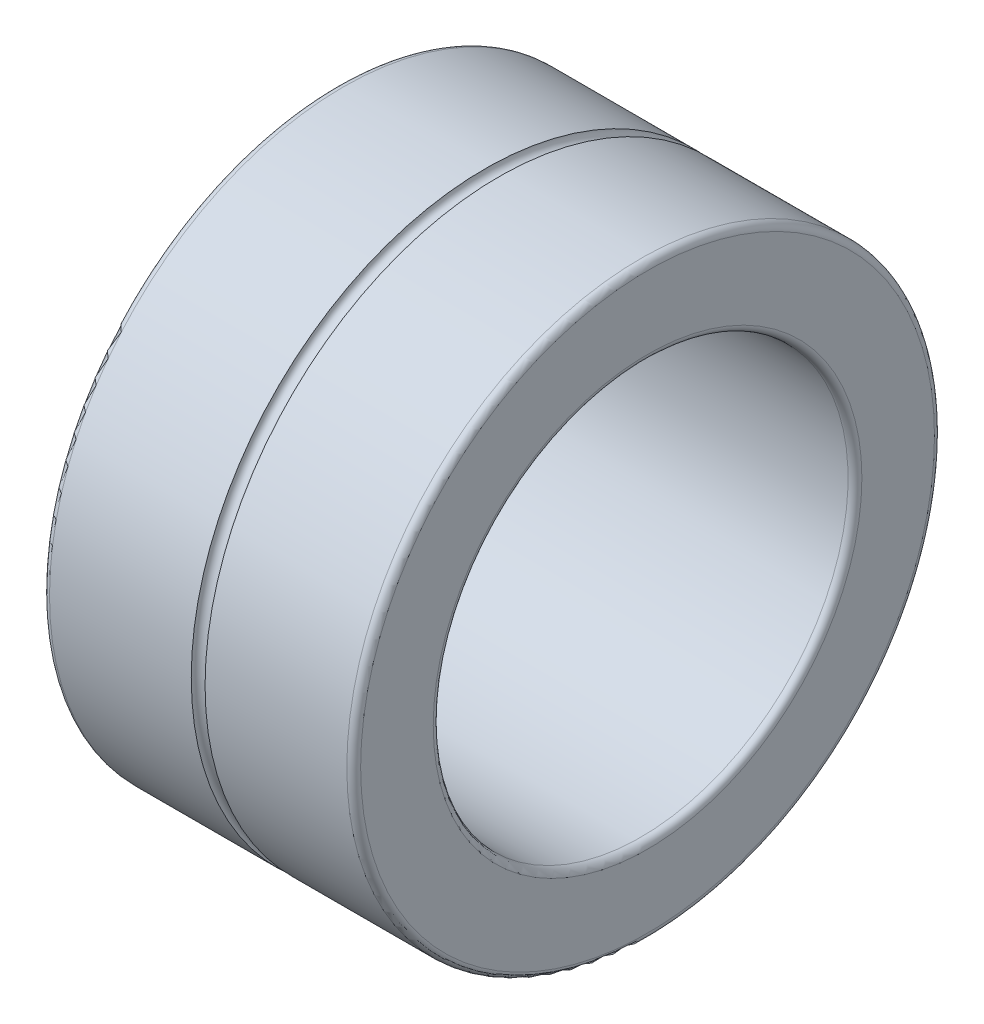
from build123d import *

# Parameters (mm, degrees)
FILLET1_R = 1


with BuildPart() as part:
    # Sketch1 → Revolve1 (revolve)
    with BuildSketch(Plane.XY, mode=Mode.PRIVATE) as revolve1_sk:
        with BuildLine():
            Line((0, 30), (0, 42.5))
            Line((0, 42.5), (21.5, 42.5))
            ThreePointArc((21.5, 42.5), (22.5, 41.5), (23.5, 42.5))
            Line((23.5, 42.5), (45, 42.5))
            Line((45, 42.5), (45, 30))
            Line((45, 30), (0, 30))
        make_face()
    revolve(revolve1_sk.sketch.rotate(Axis((0, 0, 0), (1, 0, 0)), 90), axis=Axis((0, 0, 0), (1, 0, 0)))

    # Fillet1
    fillet1_edges = [part.edges().sort_by_distance(p)[0] for p in [
        (0, 0, -30),
        (0, 0, -42.5),
        (45, 0, -42.5),
        (45, 0, -30),
    ]]
    fillet(fillet1_edges, radius=FILLET1_R)


solid = part.part
